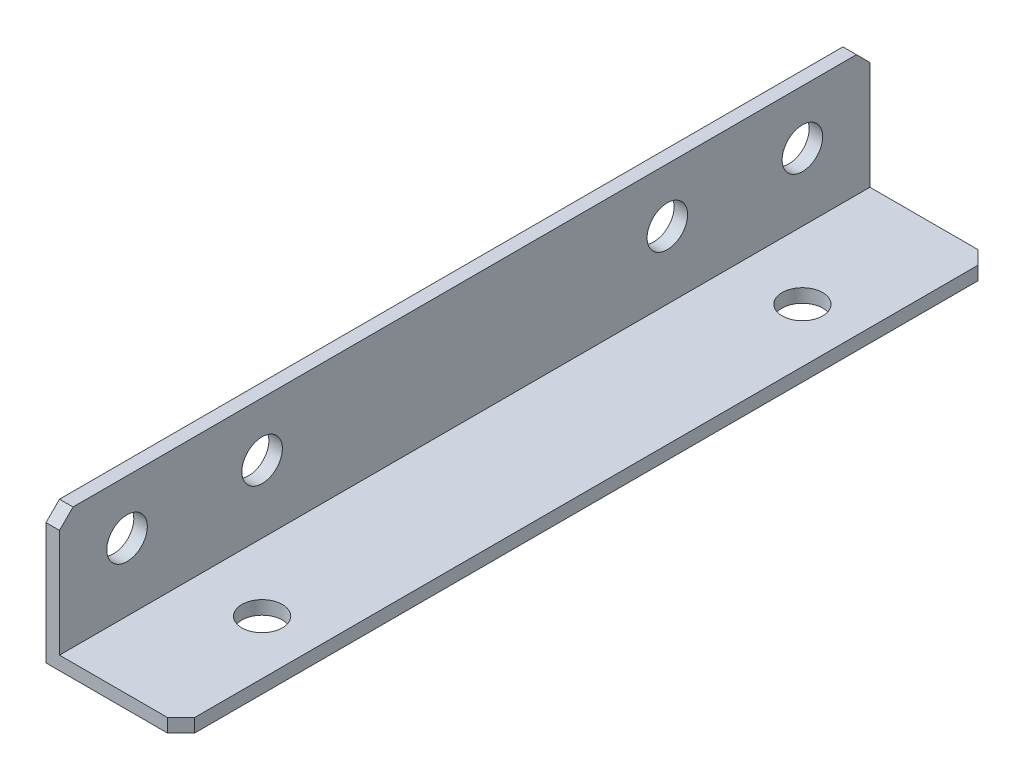
from build123d import *

# Parameters (mm, degrees)
LINEAR_AUSTRAGEN_D_NN1_DEPTH    = 30
FASE1_SIZE                      = 1
SKIZZE2_R                       = 1.5
SCHNITT_LINEAR_AUSTRAGEN1_DEPTH = 10
SKIZZE3_R                       = 1.5
SCHNITT_LINEAR_AUSTRAGEN2_DEPTH = 10


with BuildPart() as part:
    # Skizze1 → Linear-Austragen-Dünn1 (new, symmetric)
    with BuildSketch(Plane.XY):
        Polygon((0, 10), (0, 0), (10, 0), (10, 1), (1, 1), (1, 10), align=None)
    extrude(amount=LINEAR_AUSTRAGEN_D_NN1_DEPTH, both=True)

    # Fase1
    fase1_edges = [part.edges().sort_by_distance(p)[0] for p in [
        (0.5, 10, 30),
        (0.5, 10, -30),
        (10, 0.5, -30),
        (10, 0.5, 30),
    ]]
    chamfer(fase1_edges, length=FASE1_SIZE)

    # Skizze2 → Schnitt-Linear austragen1 (cut)
    with BuildSketch(Plane(origin=(1, 0, 0), x_dir=(0, 0, -1), z_dir=(1, 0, 0))):
        with Locations(Location((-15, 6, 0), (0, 0, 90))):
            Circle(SKIZZE2_R)
        with Locations(Location((15, 6, 0), (0, 0, 90))):
            Circle(SKIZZE2_R)
        with Locations(Location((-25, 6, 0), (0, 0, 90))):
            Circle(SKIZZE2_R)
        with Locations(Location((25, 6, 0), (0, 0, 90))):
            Circle(SKIZZE2_R)
    extrude(amount=-SCHNITT_LINEAR_AUSTRAGEN1_DEPTH, mode=Mode.SUBTRACT)

    # Skizze3 → Schnitt-Linear austragen2 (cut)
    with BuildSketch(Plane(origin=(0, 1, 0), x_dir=(1, 0, 0), z_dir=(0, 1, 0))):
        with Locations(Location((6, -20, 0), (0, 0, 270))):
            Circle(SKIZZE3_R)
        with Locations(Location((6, 20, 0), (0, 0, 270))):
            Circle(SKIZZE3_R)
    extrude(amount=-SCHNITT_LINEAR_AUSTRAGEN2_DEPTH, mode=Mode.SUBTRACT)


solid = part.part
